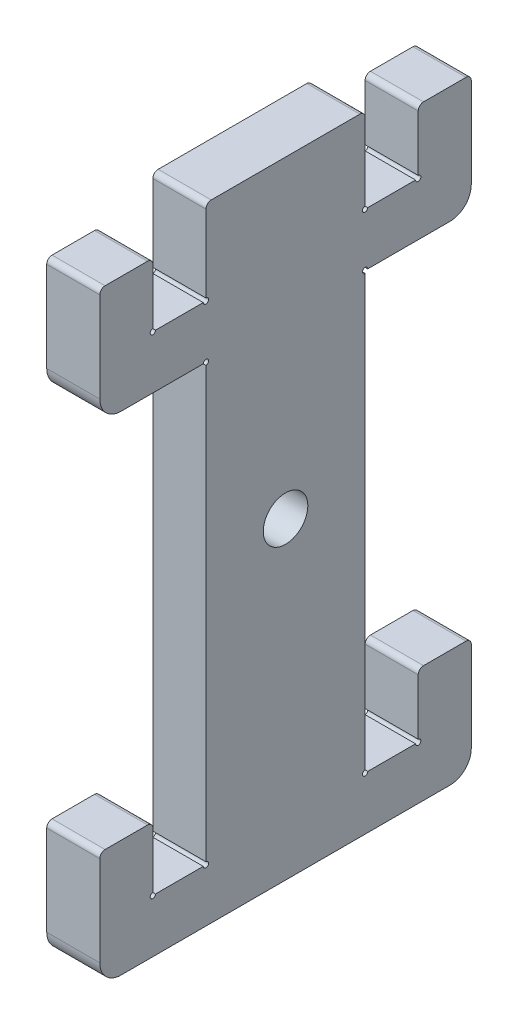
from build123d import *

# Parameters (mm, degrees)
ESQUISSE2_R        = 2.1
BOSS_EXTRU_2_DEPTH = 5


with BuildPart() as part:
    # Esquisse2 → Boss.-Extru.2 (new body)
    with BuildSketch(Plane(origin=(0, 0, 0), x_dir=(0, 0, -1), z_dir=(1, 0, 0))):
        with BuildLine():
            Line((7.750863413, -22.545340393), (12.249833074, -22.545340393))
            ThreePointArc((12.249833074, -22.545340393), (12.676550763, -22.722176075), (12.499999941, -22.295340449))
            Line((12.499999941, -22.295340449), (12.499999941, -17.045209493))
            ThreePointArc((12.499999941, -17.045209493), (12.646553376, -16.691549218), (13.000302135, -16.545209493))
            Line((13.000302135, -16.545209493), (17.000089808, -16.545209493))
            ThreePointArc((17.000089808, -16.545209493), (17.353706499, -16.69180921), (17.499999941, -17.04555272))
            Line((17.499999941, -17.04555272), (17.499999941, -25.545209493))
            ThreePointArc((17.499999941, -25.545209493), (16.9143288, -26.959538351), (15.499999941, -27.545209493))
            Line((15.499999941, -27.545209493), (-15.500000059, -27.545209493))
            ThreePointArc((-15.500000059, -27.545209493), (-16.914213621, -26.959423055), (-17.500000059, -25.545209493))
            Line((-17.500000059, -25.545209493), (-17.500000059, -17.04542182))
            ThreePointArc((-17.500000059, -17.04542182), (-17.35349126, -16.691718292), (-16.999787732, -16.545209493))
            Line((-16.999787732, -16.545209493), (-13.000000059, -16.545209493))
            ThreePointArc((-13.000000059, -16.545209493), (-12.646446668, -16.691656102), (-12.500000059, -17.045209493))
            Line((-12.500000059, -17.045209493), (-12.500000059, -22.295209493))
            ThreePointArc((-12.500000059, -22.295209493), (-12.676776754, -22.721986188), (-12.250000059, -22.545209493))
            Line((-12.250000059, -22.545209493), (-7.750394504, -22.545209493))
            ThreePointArc((-7.750394504, -22.545209493), (-7.32375732, -22.722125589), (-7.500000059, -22.295209803))
            Line((-7.500000059, -22.295209803), (-7.500000059, 18.204252682))
            ThreePointArc((-7.500000059, 18.204252682), (-7.322400285, 18.631591193), (-7.750017362, 18.454663189))
            Line((-7.750017362, 18.454663189), (-15.500000059, 18.454663189))
            ThreePointArc((-15.500000059, 18.454663189), (-16.914213621, 19.040449627), (-17.500000059, 20.454663189))
            Line((-17.500000059, 20.454663189), (-17.500000059, 28.954790507))
            ThreePointArc((-17.500000059, 28.954790507), (-17.353414349, 29.308483098), (-16.999606545, 29.454790507))
            Line((-16.999606545, 29.454790507), (-12.999606545, 29.454790507))
            ThreePointArc((-12.999606545, 29.454790507), (-12.646446514, 29.308344052), (-12.500000059, 28.955184021))
            Line((-12.500000059, 28.955184021), (-12.500000059, 23.705183903))
            ThreePointArc((-12.500000059, 23.705183903), (-12.676711319, 23.278492956), (-12.249849272, 23.454790507))
            Line((-12.249849272, 23.454790507), (-7.749606545, 23.454790507))
            ThreePointArc((-7.749606545, 23.454790507), (-7.322690777, 23.278152995), (-7.500000059, 23.704790197))
            Line((-7.500000059, 23.704790197), (-7.500000059, 30.955184021))
            ThreePointArc((-7.500000059, 30.955184021), (-7.353221822, 31.308675666), (-6.999455449, 31.454790507))
            Line((-6.999455449, 31.454790507), (6.999757524, 31.454790507))
            ThreePointArc((6.999757524, 31.454790507), (7.353328546, 31.308568754), (7.499999941, 30.955184021))
            Line((7.499999941, 30.955184021), (7.499999941, 23.704790197))
            ThreePointArc((7.499999941, 23.704790197), (7.323085388, 23.277909123), (7.749756946, 23.455328378))
            Line((7.749756946, 23.455328378), (12.250151348, 23.455328378))
            ThreePointArc((12.250151348, 23.455328378), (12.677119893, 23.279136755), (12.499999941, 23.705721037))
            Line((12.499999941, 23.705721037), (12.499999941, 28.955721891))
            ThreePointArc((12.499999941, 28.955721891), (12.646778178, 29.309213536), (13.00054455, 29.455328378))
            Line((13.00054455, 29.455328378), (17.00054455, 29.455328378))
            ThreePointArc((17.00054455, 29.455328378), (17.353745932, 29.308689359), (17.499999941, 28.955328378))
            Line((17.499999941, 28.955328378), (17.499999941, 20.454659607))
            ThreePointArc((17.499999941, 20.454659607), (16.914406065, 19.040638558), (15.50054455, 18.454659607))
            Line((15.50054455, 18.454659607), (7.75039284, 18.454659607))
            ThreePointArc((7.75039284, 18.454659607), (7.323611584, 18.631024058), (7.499999941, 18.204252682))
            Line((7.499999941, 18.204252682), (7.499999941, -22.295209803))
            ThreePointArc((7.499999941, -22.295209803), (7.32434554, -22.722243416), (7.750863413, -22.545340393))
        make_face()
        with Locations((-5.9e-08, 1.954659607)):
            Circle(ESQUISSE2_R, mode=Mode.SUBTRACT)
    extrude(amount=BOSS_EXTRU_2_DEPTH)


solid = part.part
